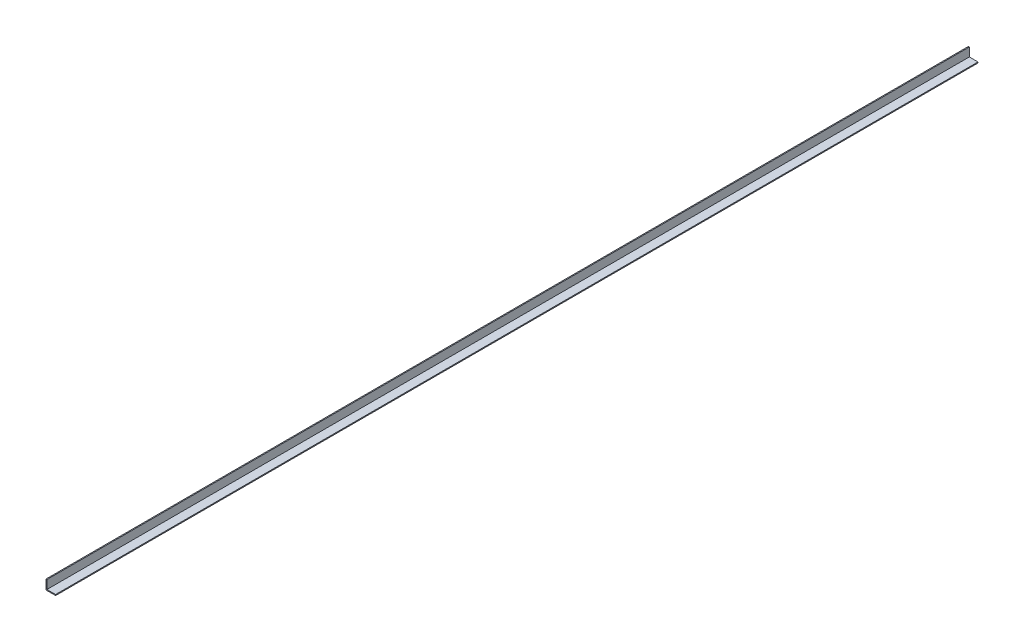
from build123d import *

# Parameters (mm, degrees)
SALIENTE_EXTRUIR1_DEPTH = 6100


with BuildPart() as part:
    # Croquis1 → Saliente-Extruir1 (new body)
    with BuildSketch(Plane.XY):
        Polygon((0, 63.5), (0, 0), (63.5, 0), (63.5, 6.35), (6.35, 6.35), (6.35, 63.5), align=None)
    extrude(amount=-SALIENTE_EXTRUIR1_DEPTH)


solid = part.part
